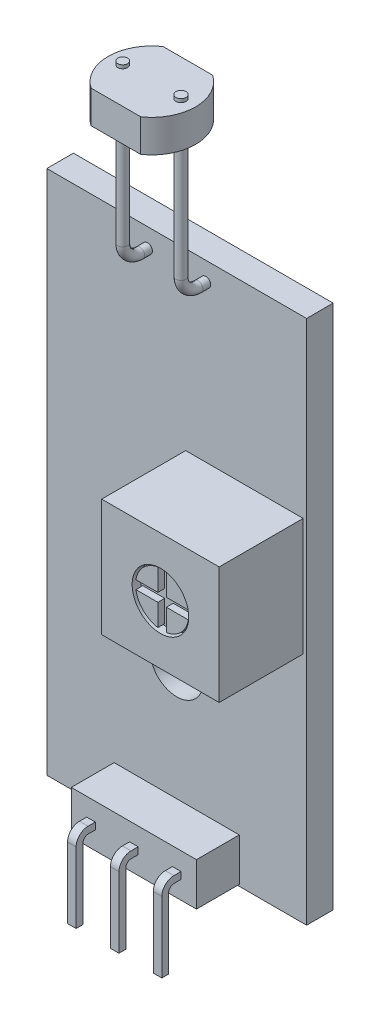
from build123d import *

# Parameters (mm, degrees)
ESBO_O1_W                = 15.15
ESBO_O1_H                = 30.65
ESBO_O1_R                = 1.55
RESSALTO_EXTRUS_O1_DEPTH = 1.55
ESBO_O2_W                = 6.85
ESBO_O2_H                = 6.85
RESSALTO_EXTRUS_O2_DEPTH = 6.45
ESBO_O3_R                = 1.65
CORTE_EXTRUS_O1_DEPTH    = 0.5
ESBO_O4_W                = 7.3
ESBO_O4_H                = 2.5
RESSALTO_EXTRUS_O3_DEPTH = 4.05
RESSALTO_EXTRUS_O5_DEPTH = 7.398508
ESBO_O12_W               = 1.34798559
ESBO_O12_H               = 5.991047065
ESBO_O12_W_2             = 0.998507844
ESBO_O12_W_3             = 2
CORTE_EXTRUS_O2_DEPTH    = 10
ESBO_O9_R                = 1.55
CORTE_EXTRUS_O3_DEPTH    = 0.1
RESSALTO_EXTRUS_O6_DEPTH = 1.9
ESBO_O18_R               = 0.297205441
ESBO_O18_R_2             = 0.285630525
RESSALTO_EXTRUS_O7_DEPTH = 0.2
ESBO_O25_R               = 0.285630525


with BuildPart() as part:
    # Esboço1 → Ressalto-extrusão1 (new body)
    with BuildSketch(Plane.XY):
        Rectangle(ESBO_O1_W, ESBO_O1_H)
        with Locations(Location((0, -6.025, 0), (0, 0, 180))):
            Circle(ESBO_O1_R, mode=Mode.SUBTRACT)
    extrude(amount=RESSALTO_EXTRUS_O1_DEPTH)

    # Esboço2 → Ressalto-extrusão2 (add)
    with BuildSketch(Plane.XY):
        with Locations((3.95, 1.7)):
            Rectangle(ESBO_O2_W, ESBO_O2_H)
    extrude(amount=RESSALTO_EXTRUS_O2_DEPTH)

    # Esboço3 → Corte-extrusão1 (cut)
    with BuildSketch(Plane.XY.offset(6.45)):
        with Locations((3.95, 1.7)):
            Circle(ESBO_O3_R)
        with BuildLine():
            Line((3.7, 1.95), (2.420294146, 1.95))
            ThreePointArc((2.420294146, 1.95), (2.853984489, 2.796015511), (3.7, 3.229705854))
            Line((3.7, 3.229705854), (3.7, 1.95))
        make_face(mode=Mode.SUBTRACT)
        with BuildLine():
            Line((5.479705854, 1.45), (4.2, 1.45))
            Line((4.2, 1.45), (4.2, 0.170294146))
            ThreePointArc((4.2, 0.170294146), (5.046015511, 0.603984489), (5.479705854, 1.45))
        make_face(mode=Mode.SUBTRACT)
        with BuildLine():
            Line((5.479705854, 1.95), (4.2, 1.95))
            Line((4.2, 1.95), (4.2, 3.229705854))
            ThreePointArc((4.2, 3.229705854), (5.046015511, 2.796015511), (5.479705854, 1.95))
        make_face(mode=Mode.SUBTRACT)
        with BuildLine():
            Line((3.7, 1.45), (3.7, 0.170294146))
            ThreePointArc((3.7, 0.170294146), (2.853984489, 0.603984489), (2.420294146, 1.45))
            Line((2.420294146, 1.45), (3.7, 1.45))
        make_face(mode=Mode.SUBTRACT)
    extrude(amount=-CORTE_EXTRUS_O1_DEPTH, mode=Mode.SUBTRACT)

    # Esboço4 → Ressalto-extrusão3 (add)
    with BuildSketch(Plane.XY):
        with Locations((0, -13.975)):
            Rectangle(ESBO_O4_W, ESBO_O4_H)
    extrude(amount=RESSALTO_EXTRUS_O3_DEPTH)

    # Esboço11 → Ressalto-extrusão5 (add)
    with BuildSketch(Plane.ZY.offset(3.65)):
        with BuildLine():
            Line((4.05, -14.175), (4.467357012, -14.175))
            ThreePointArc((4.467357012, -14.175), (4.679489046, -14.262867966), (4.767357012, -14.475))
            Line((4.767357012, -14.475), (4.767357012, -18.595051461))
            Line((4.767357012, -18.595051461), (5.167357012, -18.595051461))
            Line((5.167357012, -18.595051461), (5.167357012, -14.475))
            ThreePointArc((5.167357012, -14.475), (4.962331759, -13.980025253), (4.467357012, -13.775))
            Line((4.467357012, -13.775), (4.05, -13.775))
            Line((4.05, -13.775), (4.05, -14.175))
        make_face()
    extrude(amount=-RESSALTO_EXTRUS_O5_DEPTH)

    # Esboço12 → Corte-extrusão2 (cut)
    with BuildSketch(Plane.XY.offset(4.05)):
        with Locations((-3.423992795, -16.372351479)):
            Rectangle(ESBO_O12_W, ESBO_O12_H)
        with Locations((3.249253922, -16.372351479)):
            Rectangle(ESBO_O12_W_2, ESBO_O12_H)
        with Locations((-1.25, -16.372351479)):
            Rectangle(ESBO_O12_W_3, ESBO_O12_H)
        with Locations((1.25, -16.372351479)):
            Rectangle(ESBO_O12_W_3, ESBO_O12_H)
    extrude(amount=CORTE_EXTRUS_O2_DEPTH, mode=Mode.SUBTRACT)

    # Esboço9 → Corte-extrusão3 (cut)
    with BuildSketch(Plane.XY.offset(6.45)):
        with Locations((3.95, 1.7)):
            Circle(ESBO_O9_R)
    extrude(amount=-CORTE_EXTRUS_O3_DEPTH, mode=Mode.SUBTRACT)



with BuildPart() as body_2:
    # Esboço17 → Ressalto-extrusão6 (new body)
    with BuildSketch(Plane(origin=(0, 22.325, 0), x_dir=(1, 0, 0), z_dir=(0, 1, 0))):
        with BuildLine():
            Line((-1.446547614, -0.9), (1.446547614, -0.9))
            ThreePointArc((1.446547614, -0.9), (2.55, -3), (1.446547614, -5.1))
            Line((1.446547614, -5.1), (-1.446547614, -5.1))
            ThreePointArc((-1.446547614, -5.1), (-2.55, -3), (-1.446547614, -0.9))
        make_face()
    extrude(amount=RESSALTO_EXTRUS_O6_DEPTH)

    # Esboço18 → Ressalto-extrusão7 (add)
    with BuildSketch(Plane(origin=(0, 24.225, 0), x_dir=(1, 0, 0), z_dir=(0, 1, 0))):
        with Locations(Location((1.7, -3, 0), (0, 0, 180))):
            Circle(ESBO_O18_R)
        with Locations(Location((-1.7, -3, 0), (0, 0, 180))):
            Circle(ESBO_O18_R_2)
    extrude(amount=RESSALTO_EXTRUS_O7_DEPTH)


with BuildPart() as part_1:
    add(part.part)

    add(body_2.part)  # Varredura5 merges body 2
    # Varredura5: sweep along a path in Esboço19
    with BuildLine(Plane.ZY.offset(1.7)) as varredura5_path:
        Line((3, 22.325), (3, 15.227434518))
        ThreePointArc((3, 15.227434518), (2.707106781, 14.520327737), (2, 14.227434518))
        Line((2, 14.227434518), (1.55, 14.227434518))
    # Esboço25 → Varredura5 (sweep)
    with BuildSketch(Plane.XZ.offset(-22.325)):
        with Locations((-1.7, 3)):
            Circle(ESBO_O25_R)
    varredura5 = sweep(path=varredura5_path.line)

    # Espelhar1: Varredura5 across plane
    add(varredura5.mirror(Plane.ZY))


solid = part_1.part
